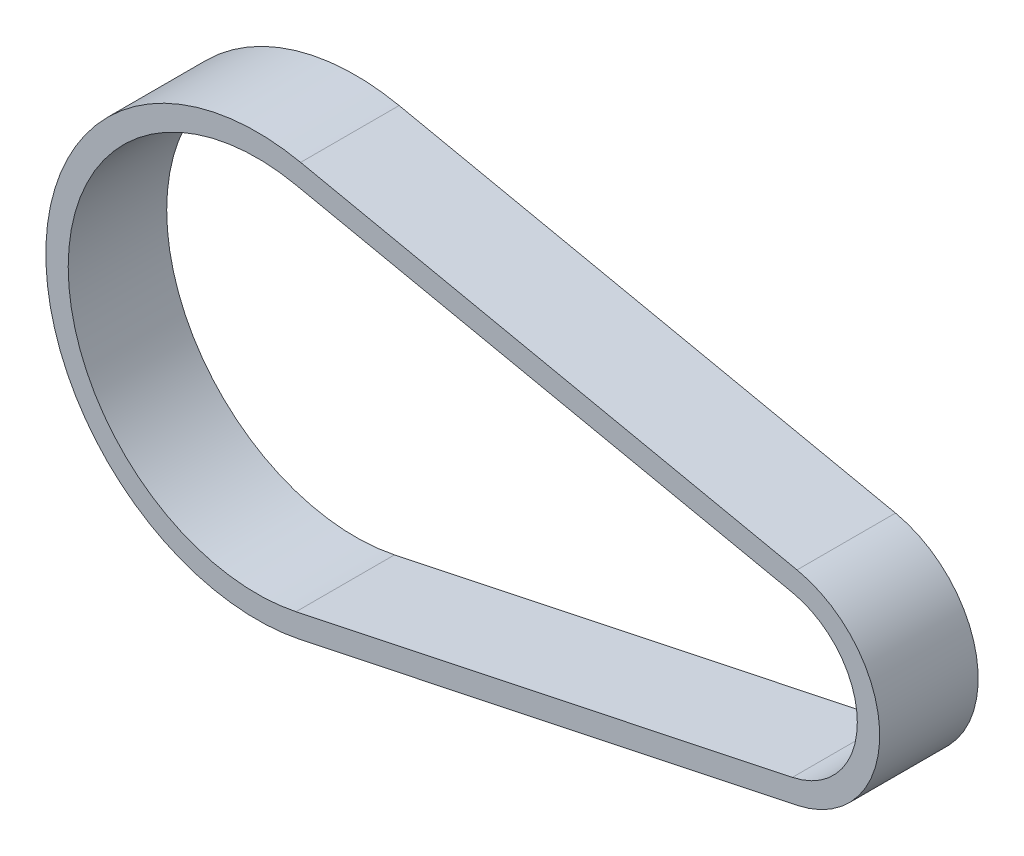
from build123d import *

# Parameters (mm, degrees)
BOSS_EXTRUDE1_DEPTH = 11


with BuildPart() as part:
    # Sketch1 → Boss-Extrude1 (new body)
    with BuildSketch(Plane.XY):
        with BuildLine():
            Line((4.870444436, 23.083663755), (60.314241777, 11.385521645))
            ThreePointArc((60.314241777, 11.385521645), (69.548187077, 8.15e-07), (60.31424174, -11.385519984))
            Line((60.31424174, -11.385519984), (4.87044284, -23.083664092))
            ThreePointArc((4.87044284, -23.083664092), (-23.59187914, 8.15e-07), (4.870444436, 23.083663755))
        make_face()
        with BuildLine():
            Line((4.354330619, 20.637518516), (59.798127778, 8.939376445))
            ThreePointArc((59.798127778, 8.939376445), (67.048187077, 9.66e-07), (59.798128035, -8.939374722))
            Line((59.798128035, -8.939374722), (4.354331214, -20.637518391))
            ThreePointArc((4.354331214, -20.637518391), (-21.09187914, -3.04e-07), (4.354330619, 20.637518516))
        make_face(mode=Mode.SUBTRACT)
    extrude(amount=BOSS_EXTRUDE1_DEPTH)


solid = part.part
